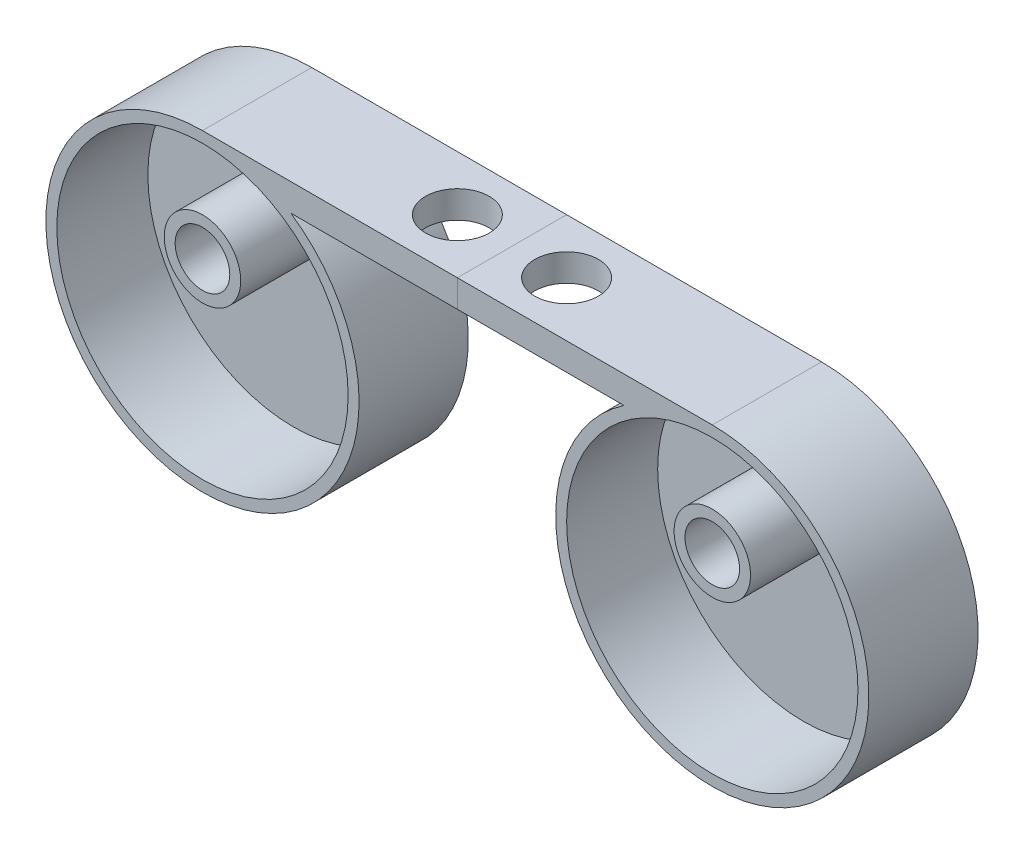
from build123d import *

# Parameters (mm, degrees)
SKETCH4_R                = 17.2
SKETCH4_R_2              = 3
BOSS_EXTRUDE3_DEPTH      = 2
SKETCH5_R                = 17.2
SKETCH5_R_2              = 16
SKETCH5_R_3              = 4.2
SKETCH5_R_4              = 3
BOSS_EXTRUDE4_DEPTH      = 10
BOSS_EXTRUDE5_REACH      = 51.829
BOSS_EXTRUDE5_END_RADIUS = 17.2
SKETCH6_W                = 12
SKETCH6_H                = 3
CUT_EXTRUDE1_REACH       = 47.95
SKETCH7_R                = 3.497879743


with BuildPart() as part:
    # Sketch4 → Boss-Extrude3 (new body)
    with BuildSketch(Plane.XY):
        Circle(SKETCH4_R)
        with Locations((0, 5)):
            Circle(SKETCH4_R_2, mode=Mode.SUBTRACT)
    extrude(amount=BOSS_EXTRUDE3_DEPTH)

    # Sketch5 → Boss-Extrude4 (add)
    # profile 1 of 2: a face of its own
    with BuildSketch(Plane.XY.offset(2)):
        Circle(SKETCH5_R)
        Circle(SKETCH5_R_2, mode=Mode.SUBTRACT)
    # profile 2 of 2: a face of its own
    with BuildSketch(Plane.XY.offset(2)):
        with Locations((0, 5)):
            Circle(SKETCH5_R_3)
        with Locations((0, 5)):
            Circle(SKETCH5_R_4, mode=Mode.SUBTRACT)
    extrude(amount=BOSS_EXTRUDE4_DEPTH)

    # Boss-Extrude5: up to this cylinder (the profile starts outside it)
    boss_extrude5_end = Plane(origin=(0, 0, 6), z_dir=(0, 0, -1)) * Cylinder(BOSS_EXTRUDE5_END_RADIUS, 139.058, mode=Mode.PRIVATE)
    # Sketch6 → Boss-Extrude5 (add, up to the surface)
    with BuildSketch(Plane(origin=(28, 0, 0), x_dir=(0, 0, -1), z_dir=(1, 0, 0)), mode=Mode.PRIVATE) as boss_extrude5_sk1:
        with Locations((-6, 15.7)):
            Rectangle(SKETCH6_W, SKETCH6_H)
    boss_extrude5_tool1 = extrude(boss_extrude5_sk1.sketch, amount=-BOSS_EXTRUDE5_REACH, mode=Mode.PRIVATE) - boss_extrude5_end
    add(boss_extrude5_tool1.solids().sort_by_distance((28, 15.7, 6))[0])

    # Sketch7 → Cut-Extrude1 (cut, up to next)
    with BuildSketch(Plane(origin=(0, 17.2, 0), x_dir=(1, 0, 0), z_dir=(0, 1, 0)), mode=Mode.PRIVATE) as cut_extrude1_sk1:
        with Locations(Location((22, -6, 0), (0, 0, 270))):
            Circle(SKETCH7_R)
    cut_extrude1_tool1 = extrude(cut_extrude1_sk1.sketch, amount=-CUT_EXTRUDE1_REACH, mode=Mode.PRIVATE) & part.part
    add(cut_extrude1_tool1.solids().sort_by_distance((22, 17.2, 6))[0], mode=Mode.SUBTRACT)


with BuildPart() as body_2:
    # Mirror1: mirrored copy
    add(part.part.mirror(Plane(origin=(28, 0, 0), x_dir=(0, 0, 1), z_dir=(1, 0, 0))))


solid = Compound([part.part, body_2.part])
